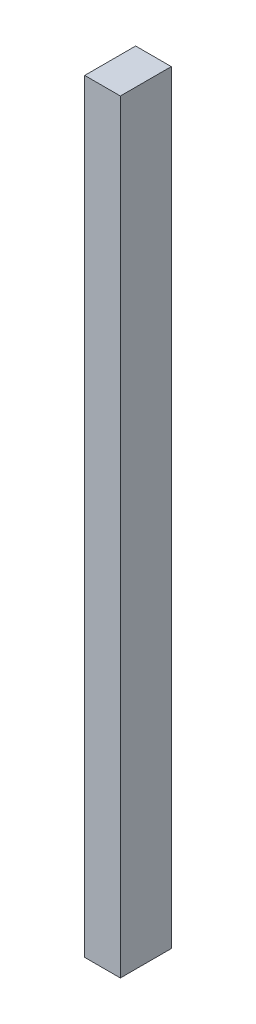
from build123d import *

# Parameters (mm, degrees)
SKETCH3_W           = 100
SKETCH3_H           = 1500
BOSS_EXTRUDE2_DEPTH = 70
CUT_EXTRUDE2_DEPTH  = 50


with BuildPart() as part:
    # Sketch3 → Boss-Extrude2 (new body)
    with BuildSketch(Plane(origin=(0, 0, 0), x_dir=(0, 0, -1), z_dir=(1, 0, 0))):
        Rectangle(SKETCH3_W, SKETCH3_H)
    extrude(amount=BOSS_EXTRUDE2_DEPTH)

    # Sketch7 → Cut-Extrude2 (cut)
    with BuildSketch(Plane(origin=(0, 0, 0), x_dir=(0, 0, -1), z_dir=(1, 0, 0))):
        with BuildLine():
            Line((20, 500), (20, -500))
            ThreePointArc((20, -500), (0, -520), (-20, -500))
            Line((-20, -500), (-20, 500))
            ThreePointArc((-20, 500), (0, 520), (20, 500))
        make_face()
    extrude(amount=CUT_EXTRUDE2_DEPTH, mode=Mode.SUBTRACT)


solid = part.part
